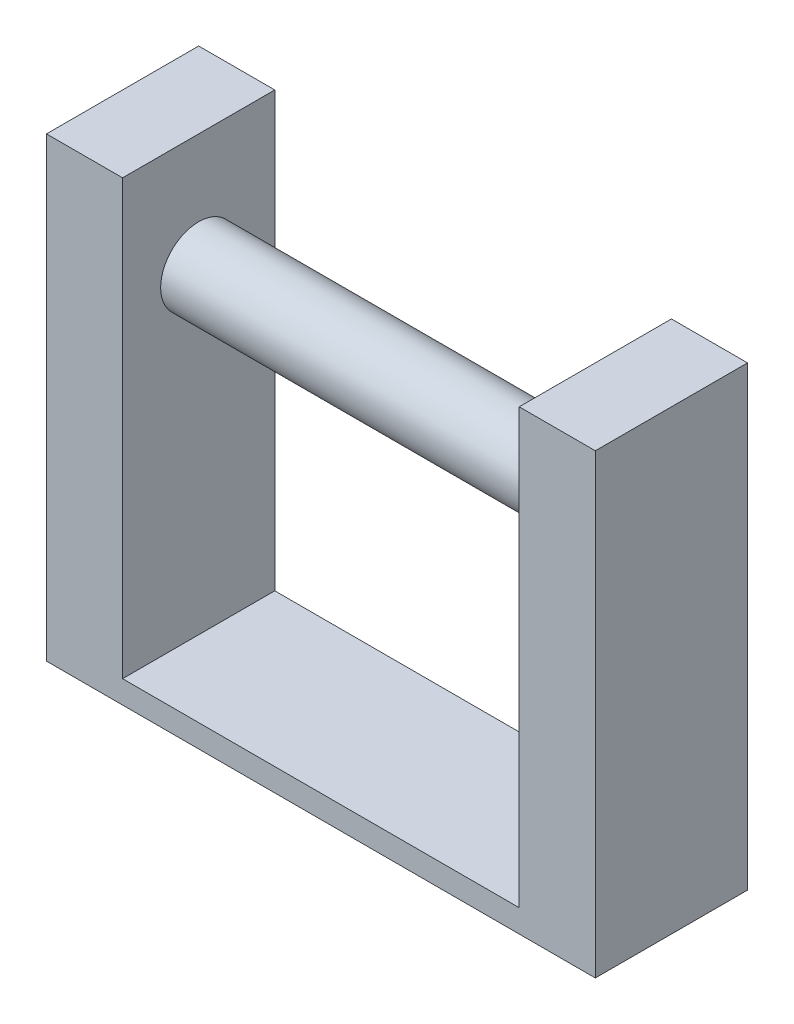
from build123d import *

# Parameters (mm, degrees)
BOSS_EXTRUDE1_DEPTH = 20
SKETCH2_R           = 5
BOSS_EXTRUDE2_DEPTH = 72.120579


with BuildPart() as part:
    # Sketch1 → Boss-Extrude1 (new body)
    with BuildSketch(Plane.XY):
        Polygon((-51.698191127, 23.057124059), (-51.698191127, -36.942875941), (20.422387717, -36.942875941), (20.422387717, 23.057124059), (10.422387717, 23.057124059), (10.422387717, -33.942875941), (-41.698191127, -33.942875941), (-41.698191127, 23.057124059), align=None)
    extrude(amount=BOSS_EXTRUDE1_DEPTH)

    # Sketch2 → Boss-Extrude2 (add)
    with BuildSketch(Plane(origin=(20.422387717, 0, 0), x_dir=(0, 0, -1), z_dir=(1, 0, 0))):
        with Locations(Location((-10, 8.057124059, 0), (0, 0, 90))):
            Circle(SKETCH2_R)
    extrude(amount=-BOSS_EXTRUDE2_DEPTH)


solid = part.part
